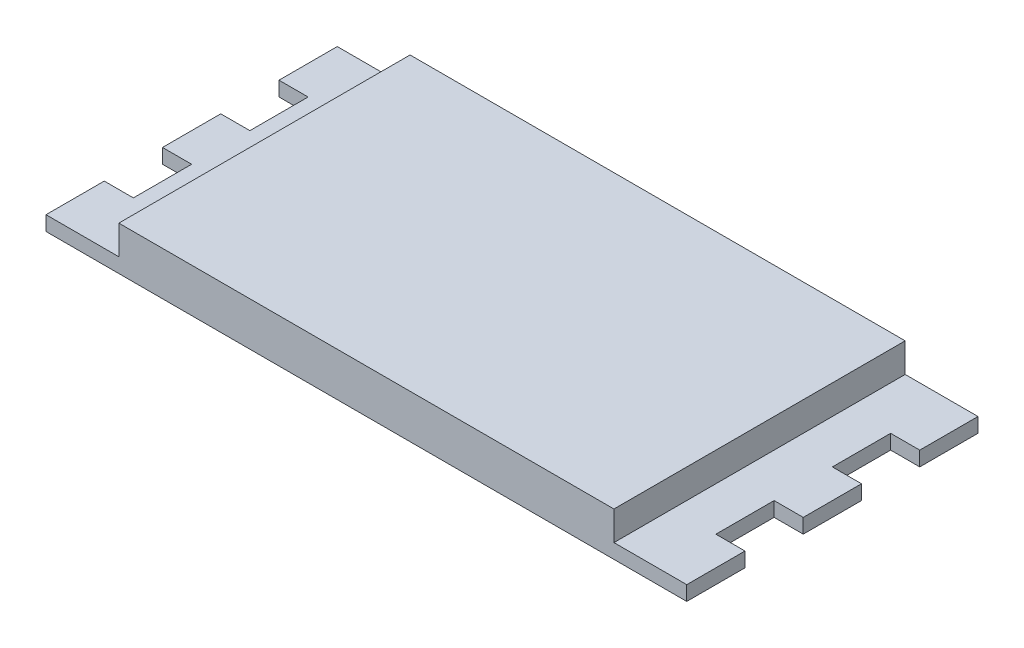
from build123d import *

# Parameters (mm, degrees)
BOSS_EXTRUDE1_DEPTH = 3
SKETCH2_W           = 5
SKETCH2_H           = 20
CUT_EXTRUDE1_DEPTH  = 2


with BuildPart() as part:
    # Sketch1 → Boss-Extrude1 (new body)
    with BuildSketch(Plane(origin=(0, 0, 0), x_dir=(1, 0, 0), z_dir=(0, 1, 0))):
        Polygon((0, 4), (0, 0), (44, 0), (44, 4), (42, 4), (42, 8), (44, 8), (44, 12), (42, 12), (42, 16), (44, 16), (44, 20), (0, 20), (0, 16), (2, 16), (2, 12), (0, 12), (0, 8), (2, 8), (2, 4), align=None)
    extrude(amount=BOSS_EXTRUDE1_DEPTH)

    # Sketch2 → Cut-Extrude1 (cut)
    with BuildSketch(Plane(origin=(0, 3, 0), x_dir=(1, 0, 0), z_dir=(0, 1, 0))):
        with Locations((41.5, 10)):
            Rectangle(SKETCH2_W, SKETCH2_H)
        with Locations((2.5, 10)):
            Rectangle(SKETCH2_W, SKETCH2_H)
    extrude(amount=-CUT_EXTRUDE1_DEPTH, mode=Mode.SUBTRACT)


solid = part.part
